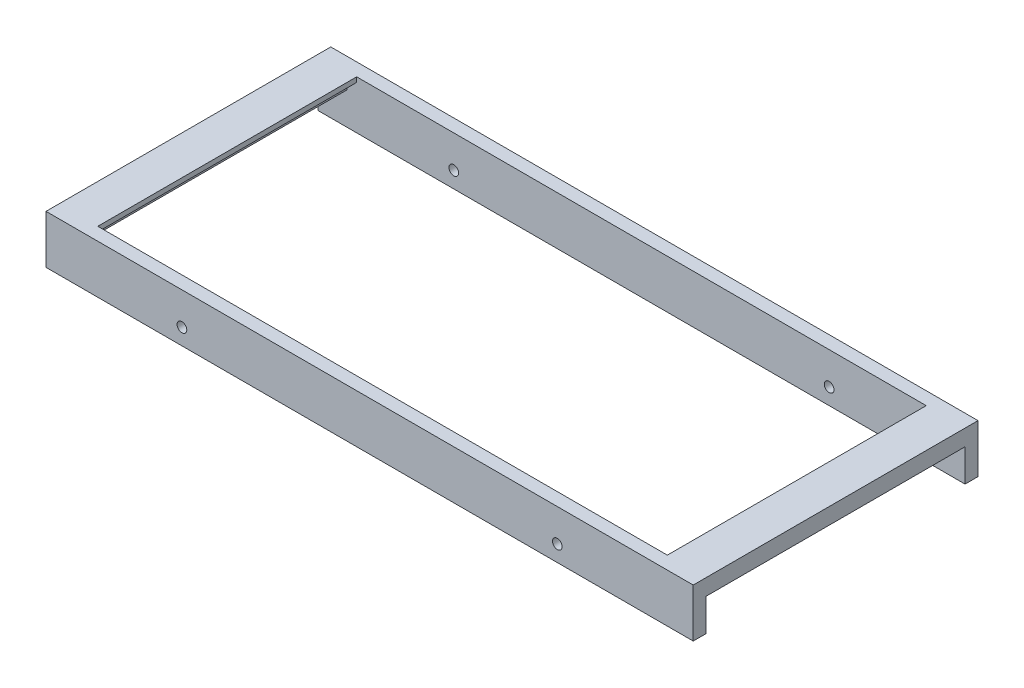
from build123d import *

# Parameters (mm, degrees)
SKETCH1_R                 = 1.5
MOUNTING_PLATE_DEPTH      = 4
RAILS_DEPTH               = 80
SKETCH1_4_W               = 182
SKETCH1_4_H               = 5
MOUNTING_PLATE_2_DEPTH    = 4
SKETCH4_W                 = 200
SKETCH4_H                 = 18.5
UNNECESSARY_PLASTIC_DEPTH = 222.057119315


with BuildPart() as part:
    # Sketch1 → Mounting Plate (new body)
    with BuildSketch(Plane.XY):
        Polygon((191, 28.5), (9, 28.5), (9, 33.5), (0, 33.5), (0, 0), (200, 0), (200, 33.5), (191, 33.5), align=None)
        with Locations((158, 23.5)):
            Circle(SKETCH1_R, mode=Mode.SUBTRACT)
        with Locations((42, 23.5)):
            Circle(SKETCH1_R, mode=Mode.SUBTRACT)
    mounting_plate = extrude(amount=MOUNTING_PLATE_DEPTH)

    # Sketch3 → Rails (add)
    with BuildSketch(Plane(origin=(0, 0, 0), x_dir=(-1, 0, 0), z_dir=(0, 0, -1))):
        Polygon((0, 28.5), (0, 33.5), (-12, 33.5), (-12, 32), (-9, 32), (-9, 28.5), align=None)
        Polygon((-188, 32), (-188, 33.5), (-200, 33.5), (-200, 28.5), (-191, 28.5), (-191, 32), align=None)
    extrude(amount=RAILS_DEPTH)

    # Sketch1<4> → Mounting Plate 2 (add)
    with BuildSketch(Plane.XY):
        with Locations((100, 31)):
            Rectangle(SKETCH1_4_W, SKETCH1_4_H)
    mounting_plate_2 = extrude(amount=MOUNTING_PLATE_2_DEPTH)

    # Mirror1: Mounting Plate, Mounting Plate 2 across plane
    add(mounting_plate.mirror(Plane.XY.offset(-40)))
    add(mounting_plate_2.mirror(Plane.XY.offset(-40)))

    # Sketch4 → Unnecessary Plastic (cut, through all)
    with BuildSketch(Plane(origin=(0, 0, -84), x_dir=(-1, 0, 0), z_dir=(0, 0, -1))):
        with Locations((-100, 9.25)):
            Rectangle(SKETCH4_W, SKETCH4_H)
    extrude(amount=-UNNECESSARY_PLASTIC_DEPTH, mode=Mode.SUBTRACT)


solid = part.part
